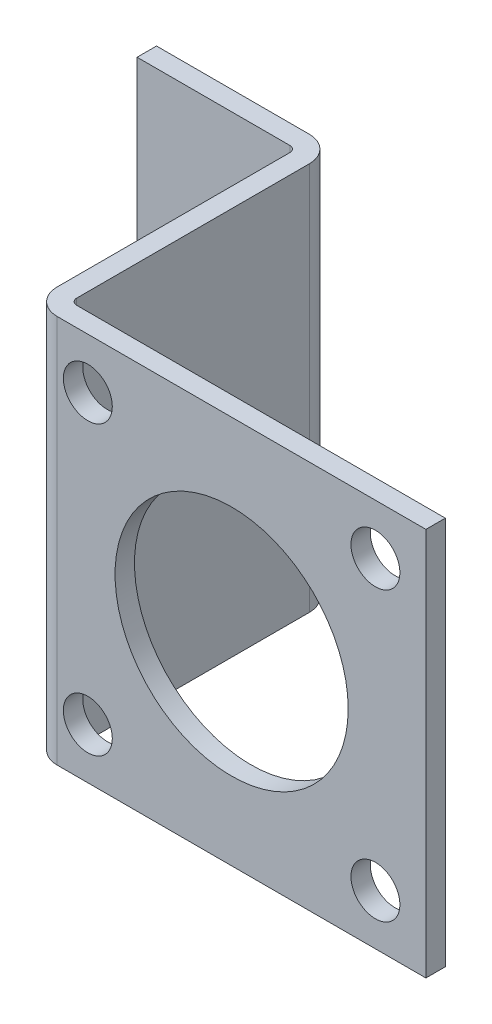
from build123d import *

# Parameters (mm, degrees)
BOSS_EXTRUDE1_DEPTH     = 31.75
CUT_EXTRUDE1_DEPTH      = 82.262795763
CUT_EXTRUDE1_DEPTH_BACK = 82.262795763
SKETCH1_R               = 19.05
SKETCH1_R_2             = 4


with BuildPart() as part:
    # Sketch2 → Boss-Extrude1 (new, symmetric)
    with BuildSketch(Plane(origin=(0, 0, 0), x_dir=(1, 0, 0), z_dir=(0, 1, 0))):
        with BuildLine():
            Line((31.75, 0), (-28.499943, 0))
            ThreePointArc((-28.499943, 0), (-31.46342752, 1.22751548), (-32.690943, 4.191))
            Line((-32.690943, 4.191), (-32.690943, 42.208958))
            ThreePointArc((-32.690943, 42.208958), (-32.98852251, 42.92737849), (-33.706943, 43.224958))
            Line((-33.706943, 43.224958), (-58.673873, 43.224958))
            Line((-58.673873, 43.224958), (-58.673873, 46.399958))
            Line((-58.673873, 46.399958), (-33.706943, 46.399958))
            ThreePointArc((-33.706943, 46.399958), (-30.74345848, 45.17244252), (-29.515943, 42.208958))
            Line((-29.515943, 42.208958), (-29.515943, 4.191))
            ThreePointArc((-29.515943, 4.191), (-29.21836349, 3.47257951), (-28.499943, 3.175))
            Line((-28.499943, 3.175), (31.75, 3.175))
            Line((31.75, 3.175), (31.75, 0))
        make_face()
    extrude(amount=BOSS_EXTRUDE1_DEPTH, both=True)

    # Sketch1 → Cut-Extrude1 (cut, two sides: drawn at the far end of the back side and taken through both)
    with BuildSketch(Plane.XY.offset(-CUT_EXTRUDE1_DEPTH_BACK)):
        Circle(SKETCH1_R)
        with Locations((23.5, 23.5)):
            Circle(SKETCH1_R_2)
        with Locations((23.5, -23.5)):
            Circle(SKETCH1_R_2)
        with Locations((-23.5, -23.5)):
            Circle(SKETCH1_R_2)
        with Locations((-23.5, 23.5)):
            Circle(SKETCH1_R_2)
    extrude(amount=CUT_EXTRUDE1_DEPTH + CUT_EXTRUDE1_DEPTH_BACK, mode=Mode.SUBTRACT)


solid = part.part
